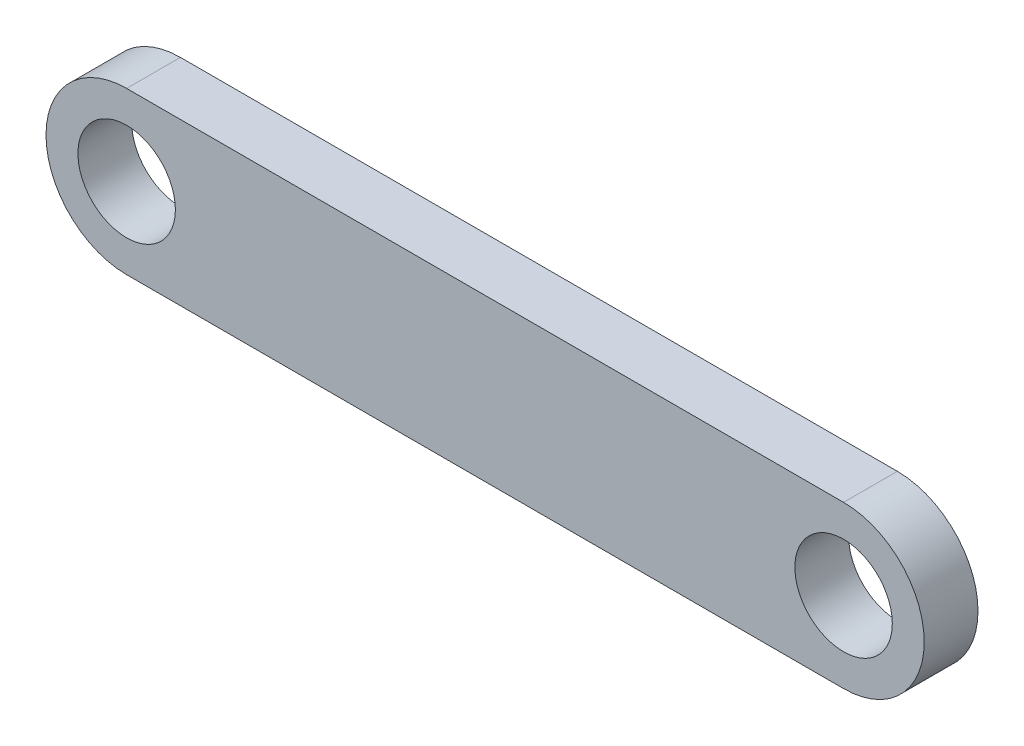
from build123d import *

# Parameters (mm, degrees)
SKETCH1_R           = 4.60375
BOSS_EXTRUDE1_DEPTH = 5.08


with BuildPart() as part:
    # Sketch1 → Boss-Extrude1 (new body)
    with BuildSketch(Plane.XY):
        with BuildLine():
            Line((0, 7.62), (67.733333333, 7.62))
            ThreePointArc((67.733333333, 7.62), (75.353333333, 0), (67.733333333, -7.62))
            Line((67.733333333, -7.62), (0, -7.62))
            ThreePointArc((0, -7.62), (-7.62, 0), (0, 7.62))
        make_face()
        Circle(SKETCH1_R, mode=Mode.SUBTRACT)
        with Locations((67.733333333, 0)):
            Circle(SKETCH1_R, mode=Mode.SUBTRACT)
    extrude(amount=BOSS_EXTRUDE1_DEPTH)


solid = part.part
